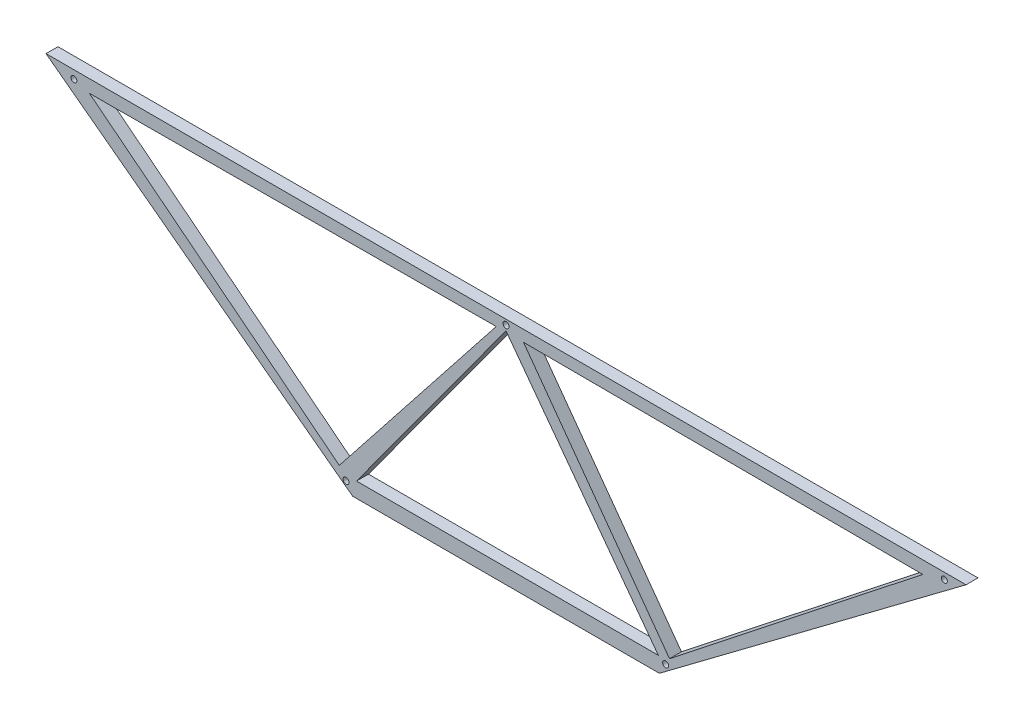
from build123d import *

# Parameters (mm, degrees)
BOSS_EXTRUDE2_DEPTH = 15.61
CUT_EXTRUDE1_DEPTH  = 672.00199113
CUT_EXTRUDE2_DEPTH  = 672.00199113
SKETCH7_R           = 3.9
CUT_EXTRUDE3_DEPTH  = 672.00199113


with BuildPart() as part:
    # Sketch2 → Boss-Extrude2 (new body)
    with BuildSketch(Plane.XY):
        Polygon((-200, 0), (200, 0), (600, 300), (-600, 300), align=None)
    extrude(amount=BOSS_EXTRUDE2_DEPTH)

    # Sketch3 → Cut-Extrude1 (cut, through all)
    with BuildSketch(Plane.XY.offset(15.61)):
        Polygon((-195, 19.678308093), (198.68730415, 19.678308093), (0, 286.78421274), align=None)
    extrude(amount=-CUT_EXTRUDE1_DEPTH, mode=Mode.SUBTRACT)

    # Sketch5 → Cut-Extrude2 (cut, through all)
    with BuildSketch(Plane.XY.offset(15.61)):
        Polygon((-217.434189149, 26.151043002), (-12.810282728, 285.331439802), (-543.331948452, 283.448560198), align=None)
        Polygon((543.539861229, 283.448560198), (22.85265332, 285.331439802), (213.236522938, 23.158727928), align=None)
    extrude(amount=-CUT_EXTRUDE2_DEPTH, mode=Mode.SUBTRACT)

    # Sketch7 → Cut-Extrude3 (cut, through all)
    with BuildSketch(Plane.XY.offset(15.61)):
        with Locations((-563.626982451, 289.376274745)):
            Circle(SKETCH7_R)
        with Locations((0, 293.39210637)):
            Circle(SKETCH7_R)
        with Locations((571.769930615, 291.724280099)):
            Circle(SKETCH7_R)
        with Locations((208.154539122, 14.26724781)):
            Circle(SKETCH7_R)
        with Locations((-208.717094574, 13.075521501)):
            Circle(SKETCH7_R)
    extrude(amount=-CUT_EXTRUDE3_DEPTH, mode=Mode.SUBTRACT)


solid = part.part
